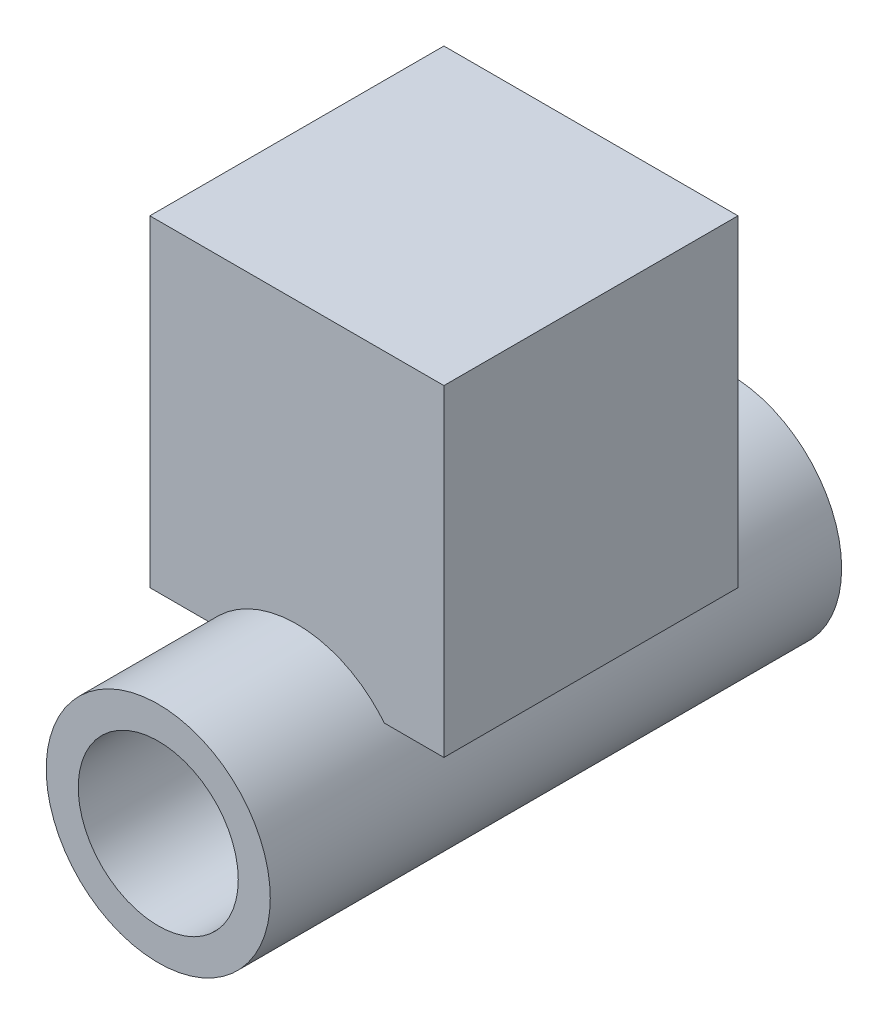
from build123d import *

# Parameters (mm, degrees)
SKETCH1_R                = 13.335
SKETCH1_R_2              = 9.525
BOSS_EXTRUDE1_DEPTH      = 68
BOSS_EXTRUDE2_DEPTH      = 33.33
BOSS_EXTRUDE2_DEPTH_BACK = 5
SKETCH3_W                = 35
SKETCH3_H                = 35


with BuildPart() as part:
    # Sketch1 → Boss-Extrude1 (new body)
    with BuildSketch(Plane.XY):
        Circle(SKETCH1_R)
        Circle(SKETCH1_R_2, mode=Mode.SUBTRACT)
    extrude(amount=-BOSS_EXTRUDE1_DEPTH)


with BuildPart() as body_2:
    # Sketch3 → Boss-Extrude2 (new, two sides: drawn at the far end of the back side and taken through both)
    with BuildSketch(Plane(origin=(0, 13.335, 0), x_dir=(0, 0, -1), z_dir=(0, 1, 0)).offset(-BOSS_EXTRUDE2_DEPTH_BACK)):
        with Locations((34, 0)):
            Rectangle(SKETCH3_W, SKETCH3_H)
    extrude(amount=BOSS_EXTRUDE2_DEPTH + BOSS_EXTRUDE2_DEPTH_BACK)


solid = Compound([part.part, body_2.part])
